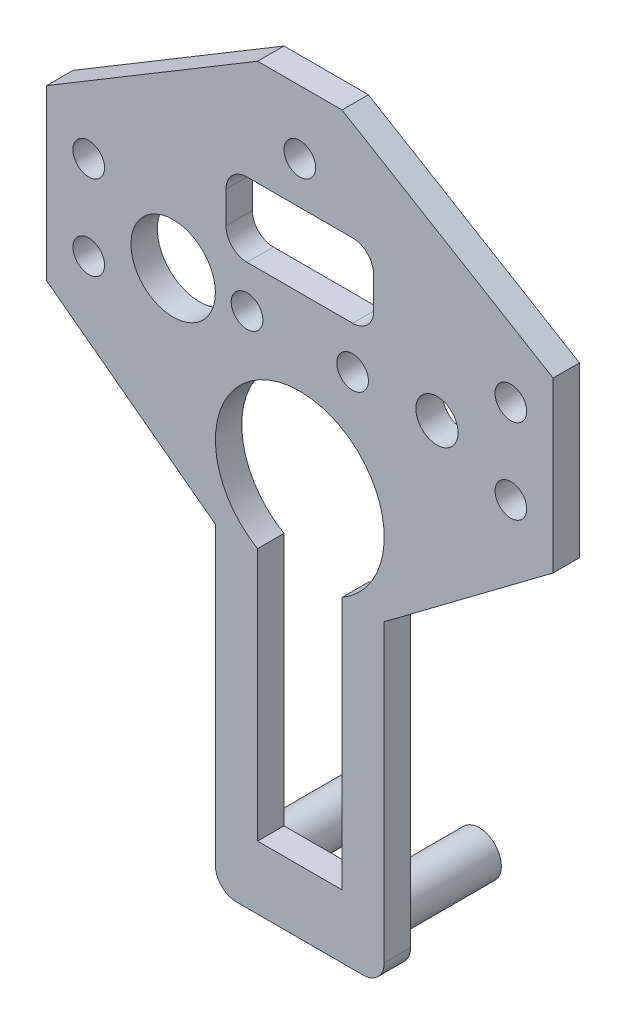
from build123d import *

# Parameters (mm, degrees)
SKETCH1_R           = 4
SKETCH1_R_2         = 1.5
SKETCH1_R_3         = 2
BOSS_EXTRUDE1_DEPTH = 2.5
SKETCH2_R           = 2.1
BOSS_EXTRUDE2_DEPTH = 9.5
SKETCH4_R           = 1.5
CUT_EXTRUDE1_DEPTH  = 5


with BuildPart() as part:
    # Sketch1 → Boss-Extrude1 (new body)
    with BuildSketch(Plane.XY):
        with BuildLine():
            Line((-24, 5.07179677), (-24, 21.07179677))
            Line((-24, 21.07179677), (-4, 33.07179677))
            Line((-4, 33.07179677), (4, 33.07179677))
            Line((4, 33.07179677), (24, 21.07179677))
            Line((24, 21.07179677), (24, 5.07179677))
            Line((24, 5.07179677), (8, -6.92820323))
            Line((8, -6.92820323), (8, -34.92820323))
            ThreePointArc((8, -34.92820323), (7.414213562, -36.342416793), (6, -36.92820323))
            Line((6, -36.92820323), (-6, -36.92820323))
            ThreePointArc((-6, -36.92820323), (-7.414213562, -36.342416793), (-8, -34.92820323))
            Line((-8, -34.92820323), (-8, -6.92820323))
            Line((-8, -6.92820323), (-24, 5.07179677))
        make_face()
        with Locations((-12, 12.07179677)):
            Circle(SKETCH1_R, mode=Mode.SUBTRACT)
        with Locations((-5, 12.07179677)):
            Circle(SKETCH1_R_2, mode=Mode.SUBTRACT)
        with Locations((5, 12.07179677)):
            Circle(SKETCH1_R_2, mode=Mode.SUBTRACT)
        with Locations((0, 27.07179677)):
            Circle(SKETCH1_R_2, mode=Mode.SUBTRACT)
        with Locations((20, 17.07179677)):
            Circle(SKETCH1_R_2, mode=Mode.SUBTRACT)
        with Locations((20, 9.07179677)):
            Circle(SKETCH1_R_2, mode=Mode.SUBTRACT)
        with Locations((-20, 17.07179677)):
            Circle(SKETCH1_R_2, mode=Mode.SUBTRACT)
        with Locations((-20, 9.07179677)):
            Circle(SKETCH1_R_2, mode=Mode.SUBTRACT)
        with Locations((13, 12.07179677)):
            Circle(SKETCH1_R_3, mode=Mode.SUBTRACT)
        with BuildLine():
            Line((4, -30.92820323), (-4, -30.92820323))
            Line((-4, -30.92820323), (-4, -6.92820323))
            ThreePointArc((-4, -6.92820323), (0, 8), (4, -6.92820323))
            Line((4, -6.92820323), (4, -30.92820323))
        make_face(mode=Mode.SUBTRACT)
        with BuildLine():
            Line((-5, 23.07179677), (5, 23.07179677))
            ThreePointArc((5, 23.07179677), (6.414213562, 22.486010332), (7, 21.07179677))
            Line((7, 21.07179677), (7, 18.07179677))
            ThreePointArc((7, 18.07179677), (6.414213562, 16.657583207), (5, 16.07179677))
            Line((5, 16.07179677), (-5, 16.07179677))
            ThreePointArc((-5, 16.07179677), (-6.414213562, 16.657583207), (-7, 18.07179677))
            Line((-7, 18.07179677), (-7, 21.07179677))
            ThreePointArc((-7, 21.07179677), (-6.414213562, 22.486010332), (-5, 23.07179677))
        make_face(mode=Mode.SUBTRACT)
    extrude(amount=BOSS_EXTRUDE1_DEPTH)

    # Sketch2 → Boss-Extrude2 (add)
    with BuildSketch(Plane(origin=(0, 0, 0), x_dir=(-1, 0, 0), z_dir=(0, 0, -1))):
        with Locations(Location((-5, -33.42820323, 0), (0, 0, 180))):
            Circle(SKETCH2_R)
        with Locations(Location((5, -33.42820323, 0), (0, 0, 180))):
            Circle(SKETCH2_R)
    extrude(amount=BOSS_EXTRUDE2_DEPTH)

    # Sketch4 → Cut-Extrude1 (cut)
    with BuildSketch(Plane(origin=(0, 0, -9.5), x_dir=(-1, 0, 0), z_dir=(0, 0, -1))):
        with Locations((-5, -33.42820323)):
            Circle(SKETCH4_R)
        with Locations((5, -33.42820323)):
            Circle(SKETCH4_R)
    extrude(amount=-CUT_EXTRUDE1_DEPTH, mode=Mode.SUBTRACT)


solid = part.part
